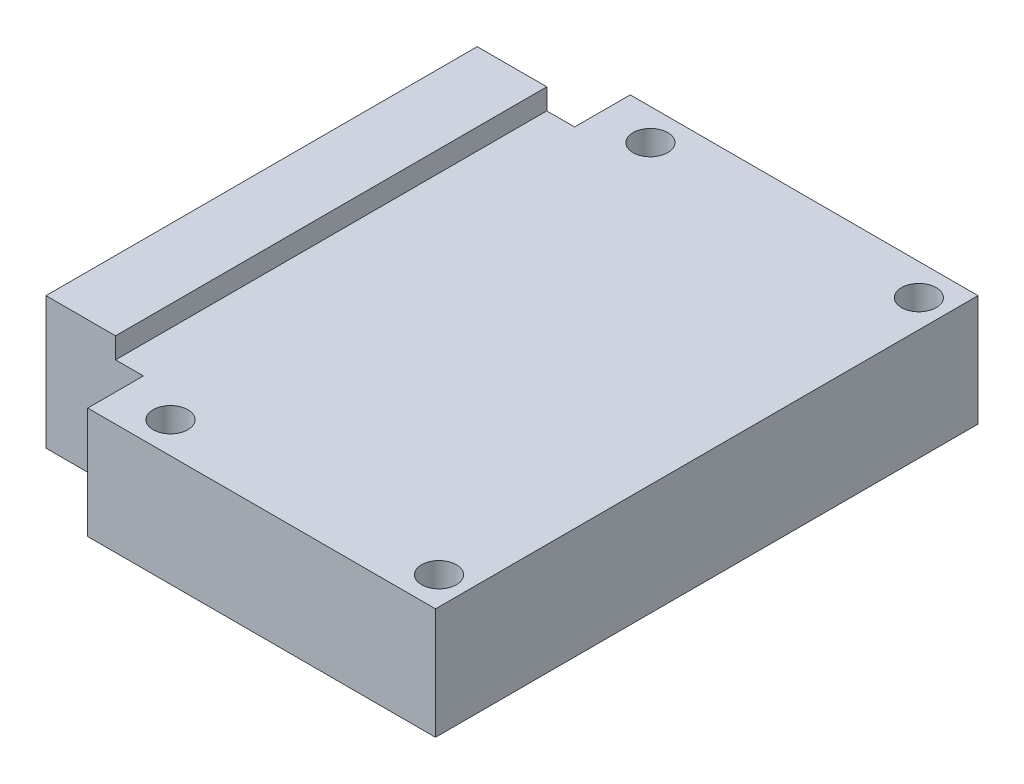
from build123d import *

# Parameters (mm, degrees)
SKETCH_2_R      = 2.5
EXTRUDE_2_DEPTH = 16
SKETCH_5_W      = 10
SKETCH_5_H      = 62
EXTRUDE_3_DEPTH = 3


with BuildPart() as part:
    # 草图2 → 凸台-拉伸2 (new body)
    with BuildSketch(Plane(origin=(0, 0, 0), x_dir=(1, 0, 0), z_dir=(0, 1, 0))):
        Polygon((-18, 39), (-18, 31), (-32, 31), (-32, -31), (-18, -31), (-18, -39), (32, -39), (32, 39), align=None)
        with Locations(Location((28, 34.5, 0), (0, 0, 270))):
            Circle(SKETCH_2_R, mode=Mode.SUBTRACT)
        with Locations(Location((-10.6, 34.5, 0), (0, 0, 270))):
            Circle(SKETCH_2_R, mode=Mode.SUBTRACT)
        with Locations(Location((28, -34.5, 0), (0, 0, 270))):
            Circle(SKETCH_2_R, mode=Mode.SUBTRACT)
        with Locations(Location((-10.6, -34.5, 0), (0, 0, 270))):
            Circle(SKETCH_2_R, mode=Mode.SUBTRACT)
    extrude(amount=EXTRUDE_2_DEPTH)

    # 草图5 → 凸台-拉伸3 (add)
    with BuildSketch(Plane(origin=(0, 16, 0), x_dir=(1, 0, 0), z_dir=(0, 1, 0))):
        with Locations((-27, 0)):
            Rectangle(SKETCH_5_W, SKETCH_5_H)
    extrude(amount=EXTRUDE_3_DEPTH)


solid = part.part
